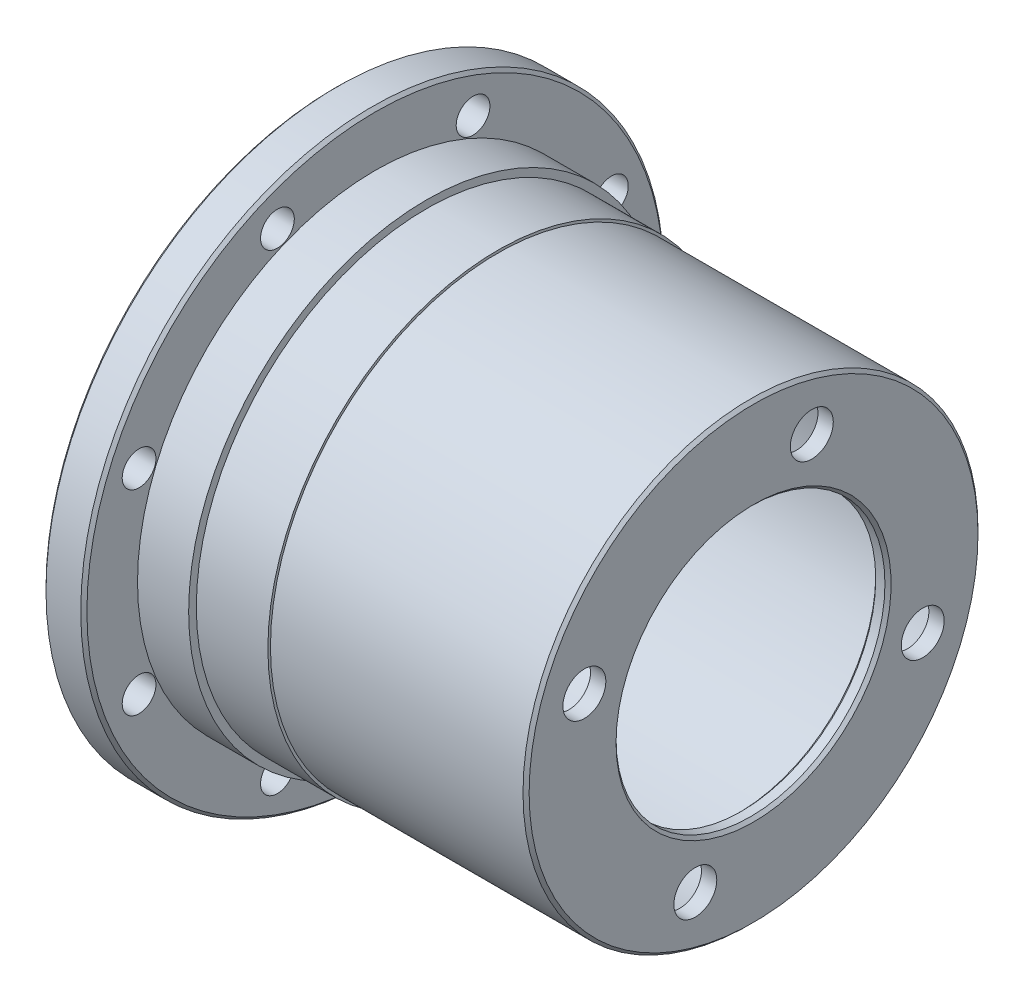
from build123d import *

# Parameters (mm, degrees)
CHAMFER_1_SIZE           = 0.3
SKETCH_2_R               = 2.1
CUT_EXTRUDE_1_DEPTH      = 58.493477891
PATTERN_CIRCULAR_1_COUNT = 4
HOLE_WIZARD_M4_1_D       = 3.3
PATTERN_CIRCULAR_2_COUNT = 8


with BuildPart() as part:
    # 草图1 → 旋转1 (revolve)
    with BuildSketch(Plane.XY, mode=Mode.PRIVATE) as revolve_1_sk:
        Polygon((0, 28.5), (0, 21.05), (39.5, 21.05), (39.5, 13.15), (41, 13.15), (41, 22.25), (16, 22.25), (16, 22.5), (9, 22.5), (9, 23.25), (4, 23.25), (4, 28.5), align=None)
    revolve(revolve_1_sk.sketch.rotate(Axis((0, 0, 0), (1, 0, 0)), 90), axis=Axis((0, 0, 0), (1, 0, 0)))

    # 倒角1
    chamfer_1_edges = [part.edges().sort_by_distance(p)[0] for p in [
        (41, 0, -13.15),
        (41, 0, -22.25),
        (4, 0, -28.5),
        (0, 0, -28.5),
        (39.5, 0, -13.15),
    ]]
    chamfer(chamfer_1_edges, length=CHAMFER_1_SIZE)

    # 草图2 → 切除-拉伸1 (cut, symmetric)
    with BuildSketch(Plane(origin=(41, 0, 0), x_dir=(0, 0, -1), z_dir=(1, 0, 0))):
        with Locations((5.697442703, 16.546575073)):
            Circle(SKETCH_2_R)
    cut_extrude_1 = extrude(amount=CUT_EXTRUDE_1_DEPTH, both=True, mode=Mode.SUBTRACT)

    # 阵列(圆周)1: 切除-拉伸1 ×4 about axis
    pattern_circular_1_axis = Axis((0, 0, 0), (1, 0, 0))
    for i in range(1, PATTERN_CIRCULAR_1_COUNT):
        add(cut_extrude_1.rotate(pattern_circular_1_axis, i * 360 / PATTERN_CIRCULAR_1_COUNT), mode=Mode.SUBTRACT)

    # M4 螺纹孔1 (through all)
    with Locations(Plane.ZY):
        with Locations((-9.567085809, -23.096988313)):
            hole_wizard_m4_1 = Hole(HOLE_WIZARD_M4_1_D / 2)

    # 阵列(圆周)2: M4 螺纹孔1 ×8 about axis
    pattern_circular_2_axis = Axis((0, 0, 0), (1, 0, 0))
    for i in range(1, PATTERN_CIRCULAR_2_COUNT):
        add(hole_wizard_m4_1.rotate(pattern_circular_2_axis, i * 360 / PATTERN_CIRCULAR_2_COUNT), mode=Mode.SUBTRACT)


solid = part.part
